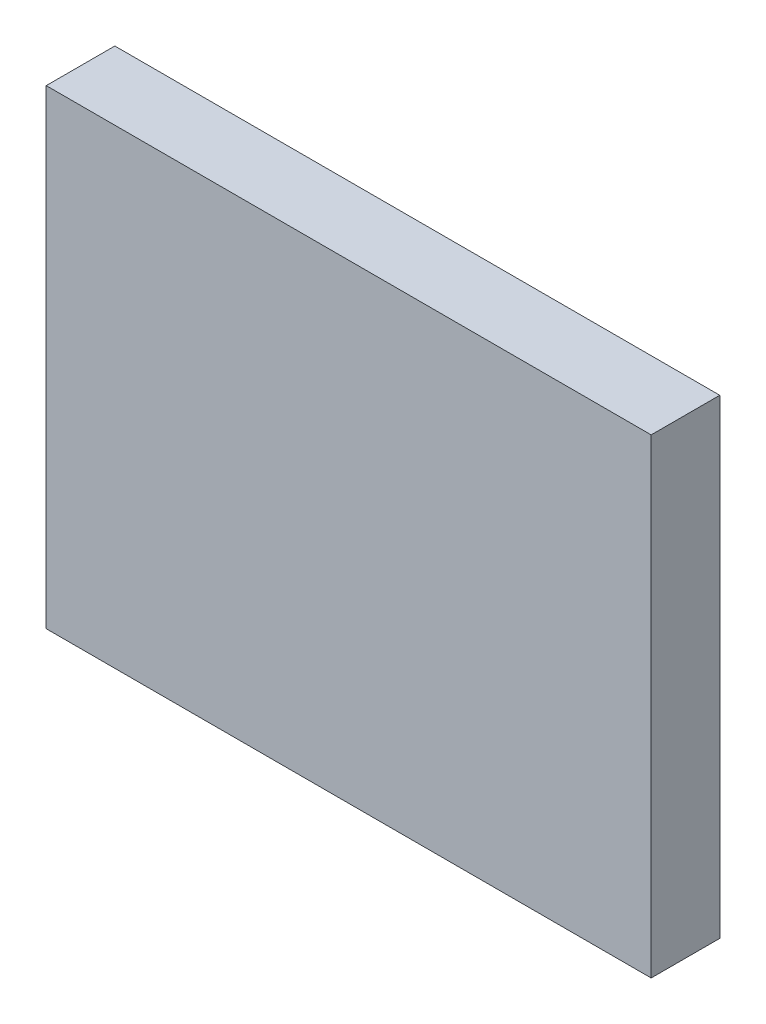
from build123d import *

# Parameters (mm, degrees)
SKETCH1_W           = 56
SKETCH1_H           = 43.54256213
BOSS_EXTRUDE1_DEPTH = 6.35


with BuildPart() as part:
    # Sketch1 → Boss-Extrude1 (new body)
    with BuildSketch(Plane.XY):
        with Locations((21.65, 18.228718935)):
            Rectangle(SKETCH1_W, SKETCH1_H)
    extrude(amount=BOSS_EXTRUDE1_DEPTH)


solid = part.part
